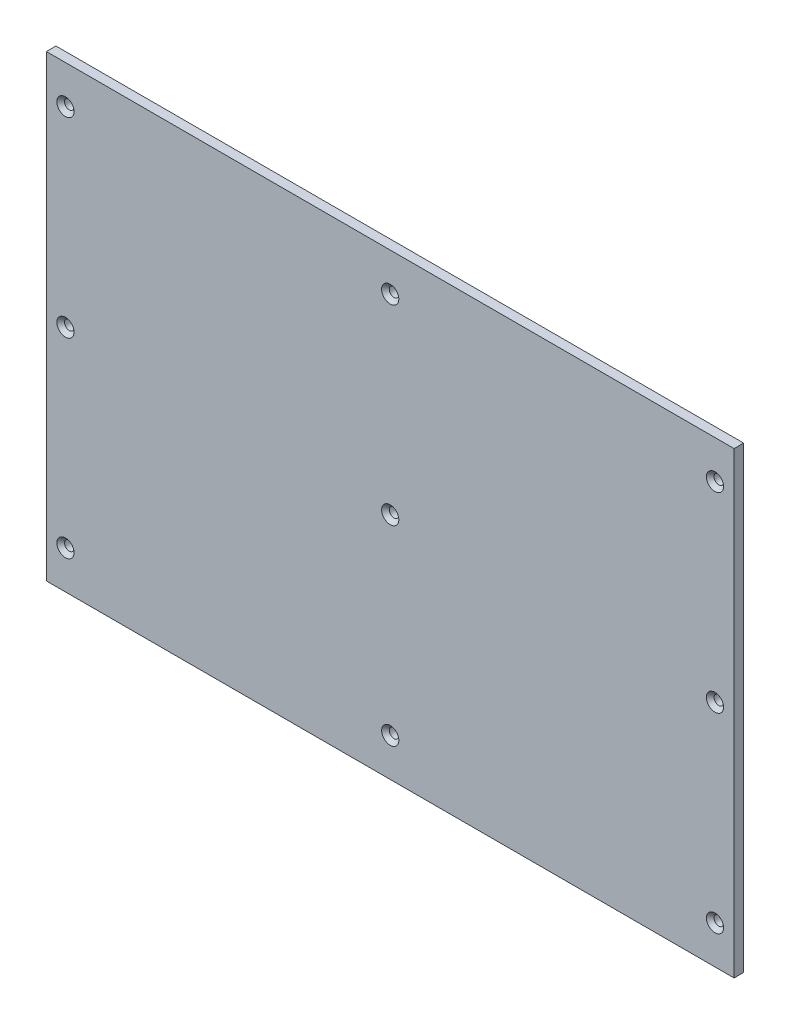
from build123d import *

# Parameters (mm, degrees)
ESQUISSE1_W             = 360
ESQUISSE1_H             = 240
BOSS_EXTRU_1_DEPTH      = 5
ESQUISSE2_R             = 2.5
ENL_V_MAT_EXTRU_1_DEPTH = 217.390850084
CHANFREIN1_SIZE         = 2


with BuildPart() as part:
    # Esquisse1 → Boss.-Extru.1 (new body)
    with BuildSketch(Plane.XY):
        Rectangle(ESQUISSE1_W, ESQUISSE1_H)
    extrude(amount=BOSS_EXTRU_1_DEPTH)

    # Esquisse2 → Enlèv. mat.-Extru.1 (cut, through all)
    with BuildSketch(Plane.XY.offset(5)):
        with Locations((-170, 100)):
            Circle(ESQUISSE2_R)
        with Locations((-170, 0)):
            Circle(ESQUISSE2_R)
        with Locations((-170, -100)):
            Circle(ESQUISSE2_R)
        with Locations((0, 100)):
            Circle(ESQUISSE2_R)
        Circle(ESQUISSE2_R)
        with Locations((0, -100)):
            Circle(ESQUISSE2_R)
        with Locations((170, -100)):
            Circle(ESQUISSE2_R)
        with Locations((170, 0)):
            Circle(ESQUISSE2_R)
        with Locations((170, 100)):
            Circle(ESQUISSE2_R)
    extrude(amount=-ENL_V_MAT_EXTRU_1_DEPTH, mode=Mode.SUBTRACT)

    # Chanfrein1
    chanfrein1_edges = [part.edges().sort_by_distance(p)[0] for p in [
        (-172.5, 0, 5),
        (-172.5, -100, 5),
        (-2.5, 100, 5),
        (-2.5, 0, 5),
        (-2.5, -100, 5),
        (167.5, -100, 5),
        (167.5, 0, 5),
        (167.5, 100, 5),
        (-172.5, 100, 5),
    ]]
    chamfer(chanfrein1_edges, length=CHANFREIN1_SIZE)


solid = part.part
